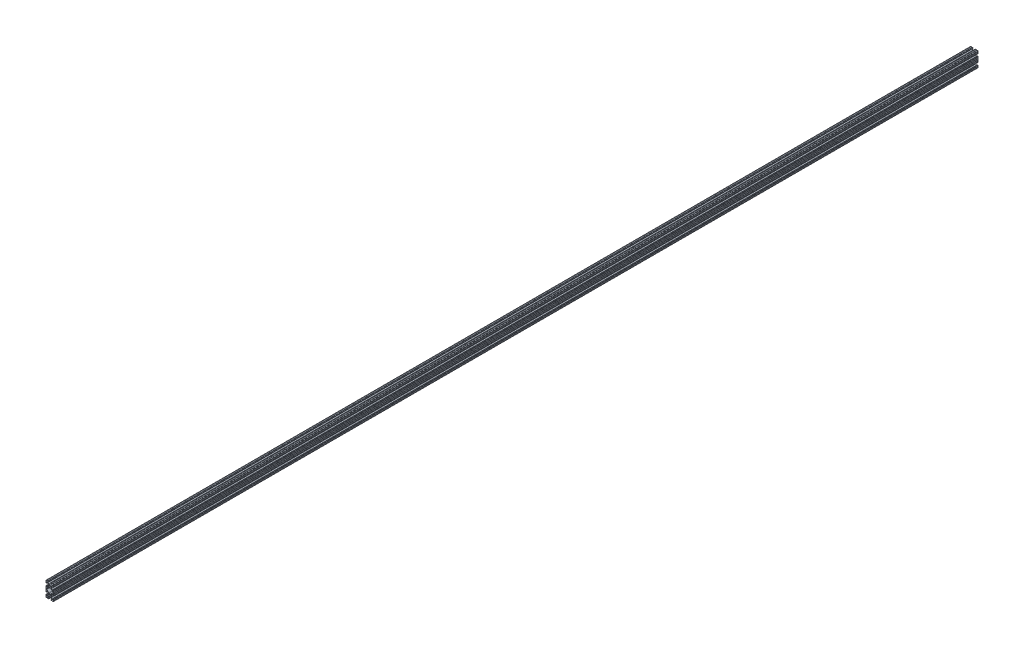
from build123d import *

# Parameters (mm, degrees)
BOSS_EXTRUDE1_DEPTH     = 1524
CUT_EXTRUDE1_DEPTH      = 1525.26456037
CUT_EXTRUDE1_DEPTH_BACK = 1525.26456037
SKETCH5_R               = 0.55245
BOSS_EXTRUDE2_DEPTH     = 1524
CUT_EXTRUDE2_DEPTH      = 1525.26456037
CUT_EXTRUDE2_DEPTH_BACK = 1525.26456037


with BuildPart() as part:
    # Sketch4 → Boss-Extrude1 (new, symmetric)
    with BuildSketch(Plane.XY):
        with BuildLine():
            Line((4.190365, -25.4), (10.11729625, -25.4))
            ThreePointArc((10.11729625, -25.4), (11.943543585, -24.643543585), (12.7, -22.81729625))
            Line((12.7, -22.81729625), (12.7, -16.890365))
            ThreePointArc((12.7, -16.890365), (12.42492494, -16.22627506), (11.760835, -15.9512))
            Line((11.760835, -15.9512), (11.429365, -15.9512))
            ThreePointArc((11.429365, -15.9512), (10.76527506, -16.22627506), (10.4902, -16.890365))
            Line((10.4902, -16.890365), (10.4902, -19.048478019))
            ThreePointArc((10.4902, -19.048478019), (9.830707141, -20.035478831), (8.666460301, -19.803895736))
            Line((8.666460301, -19.803895736), (5.299899128, -16.437334563))
            ThreePointArc((5.299899128, -16.437334563), (4.817571085, -15.715479634), (4.6482, -14.86399369))
            Line((4.6482, -14.86399369), (4.6482, -12.7))
            Line((4.6482, -12.7), (2.6035, -12.7))
            ThreePointArc((2.6035, -12.7), (1.840952505, -14.540952505), (0, -15.3035))
            Line((0, -15.3035), (0, -17.3482))
            Line((0, -17.3482), (2.16399369, -17.3482))
            ThreePointArc((2.16399369, -17.3482), (3.015479634, -17.517571085), (3.737334563, -17.999899128))
            Line((3.737334563, -17.999899128), (7.103895736, -21.366460301))
            ThreePointArc((7.103895736, -21.366460301), (7.335478831, -22.530707141), (6.348478019, -23.1902))
            Line((6.348478019, -23.1902), (4.190365, -23.1902))
            ThreePointArc((4.190365, -23.1902), (3.52627506, -23.46527506), (3.2512, -24.129365))
            Line((3.2512, -24.129365), (3.2512, -24.460835))
            ThreePointArc((3.2512, -24.460835), (3.52627506, -25.12492494), (4.190365, -25.4))
        make_face()
    extrude(amount=BOSS_EXTRUDE1_DEPTH, both=True)

    # Sketch5 → Cut-Extrude1 (cut, two sides: drawn at the far end of the back side and taken through both)
    with BuildSketch(Plane.XY.offset(-CUT_EXTRUDE1_DEPTH_BACK)):
        with Locations((10.356153152, -25.4)):
            Circle(SKETCH5_R)
        with Locations((5.796028019, -25.4)):
            Circle(SKETCH5_R)
        with Locations((12.7, -23.056153152)):
            Circle(SKETCH5_R)
        with Locations((12.7, -18.496028019)):
            Circle(SKETCH5_R)
    extrude(amount=CUT_EXTRUDE1_DEPTH + CUT_EXTRUDE1_DEPTH_BACK, mode=Mode.SUBTRACT)

    # Mirror1: part across plane


with BuildPart() as part_1:
    add(part.part)
    add(part.part.mirror(Plane(origin=(4.6482, -12.7, 1524), x_dir=(0, 0, 1), z_dir=(0, -1, 0))))

    # Sketch6 → Boss-Extrude2 (add, symmetric)
    with BuildSketch(Plane.XY):
        with BuildLine():
            Line((12.7, -1.791396848), (12.7, 0))
            Line((12.7, 0), (9.803703152, 0))
            Line((9.803703152, 0), (9.803703152, -2.343846848))
            Line((9.803703152, -2.343846848), (12.14755, -2.343846848))
            ThreePointArc((12.14755, -2.343846848), (12.309358859, -1.953205706), (12.7, -1.791396848))
        make_face()
    extrude(amount=BOSS_EXTRUDE2_DEPTH, both=True)

    # Sketch7 → Cut-Extrude2 (cut, two sides: drawn at the far end of the back side and taken through both)
    with BuildSketch(Plane.XY.offset(-CUT_EXTRUDE2_DEPTH_BACK)):
        with BuildLine():
            Line((5.420615149, -5.716820286), (10.328391141, -0.809044294))
            ThreePointArc((10.328391141, -0.809044294), (10.448147248, -0.629816615), (10.4902, -0.418403152))
            Line((10.4902, -0.418403152), (10.4902, 0))
            Line((10.4902, 0), (0, 0))
            Line((0, 0), (5.420615149, -5.716820286))
        make_face()
    extrude(amount=CUT_EXTRUDE2_DEPTH + CUT_EXTRUDE2_DEPTH_BACK, mode=Mode.SUBTRACT)

    # Mirror2: part across plane


with BuildPart() as part_2:
    add(part_1.part)
    add(part_1.part.mirror(Plane.ZX))

    # Mirror3: part across plane


with BuildPart() as part_3:
    add(part_2.part)
    add(part_2.part.mirror(Plane(origin=(0, 0, 0), x_dir=(0, 0, 1), z_dir=(1, 0, 0))))


solid = part_3.part
